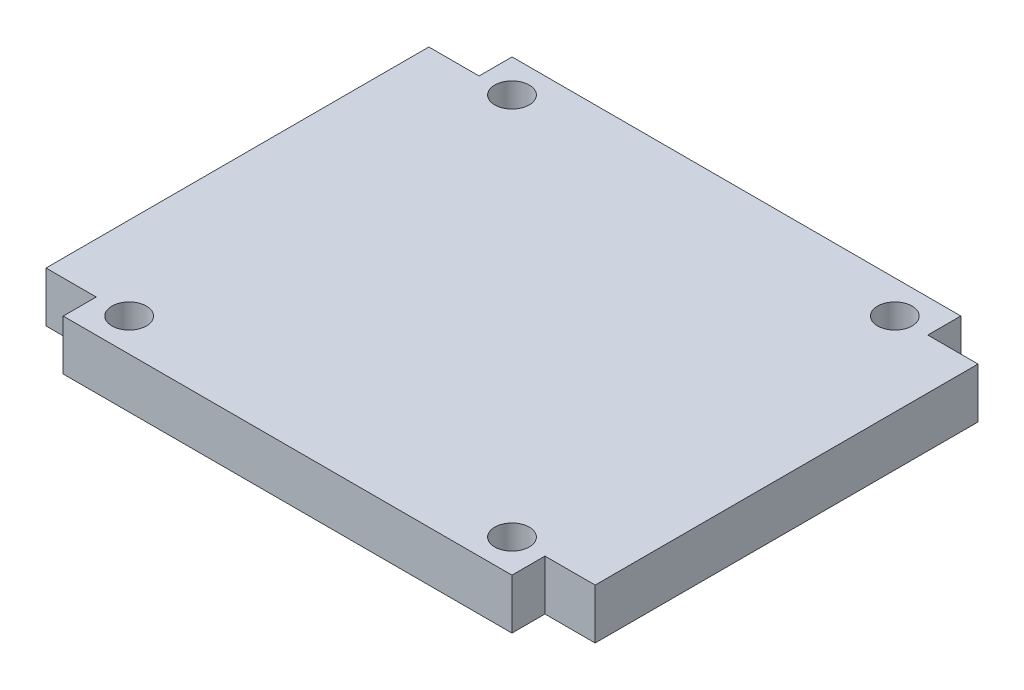
from build123d import *

# Parameters (mm, degrees)
BOSS_EXTRUDE1_DEPTH = 4
SKETCH1_R           = 1.375
CUT_EXTRUDE1_DEPTH  = 4


with BuildPart() as part:
    # Sketch2 → Boss-Extrude1 (new body)
    with BuildSketch(Plane(origin=(0, 0, 0), x_dir=(1, 0, 0), z_dir=(0, 1, 0))):
        Polygon((17.875, 15.25), (21.875, 15.25), (21.875, -15.25), (17.875, -15.25), (17.875, -17.88), (-17.875, -17.88), (-17.875, -15.25), (-21.875, -15.25), (-21.875, 15.25), (-17.875, 15.25), (-17.875, 17.88), (17.875, 17.88), align=None)
    extrude(amount=BOSS_EXTRUDE1_DEPTH)

    # Sketch1 → Cut-Extrude1 (cut)
    with BuildSketch(Plane(origin=(0, 0, 0), x_dir=(1, 0, 0), z_dir=(0, 1, 0))):
        with Locations(Location((-15.25, 15.25, 0), (0, 0, 270))):
            Circle(SKETCH1_R)
        with Locations(Location((15.25, 15.25, 0), (0, 0, 270))):
            Circle(SKETCH1_R)
        with Locations(Location((15.25, -15.25, 0), (0, 0, 270))):
            Circle(SKETCH1_R)
        with Locations(Location((-15.25, -15.25, 0), (0, 0, 270))):
            Circle(SKETCH1_R)
    extrude(amount=CUT_EXTRUDE1_DEPTH, mode=Mode.SUBTRACT)


solid = part.part
